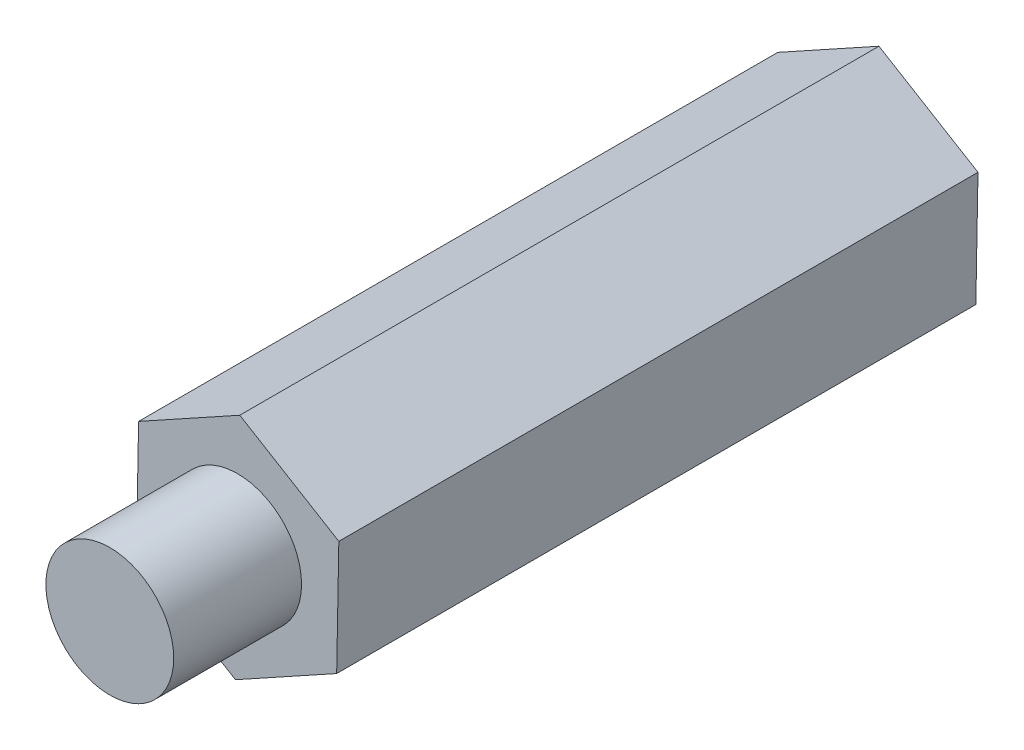
from build123d import *

# Parameters (mm, degrees)
EXTRUDE_1_DEPTH     = 15
SKETCH_2_R          = 1.5
EXTRUDE_2_DEPTH     = 3
SKETCH_3_R          = 1.5
CUT_EXTRUDE_1_DEPTH = 3


with BuildPart() as part:
    # 草图1 → 凸台-拉伸1 (new body)
    with BuildSketch(Plane.XY):
        Polygon((-2.324213399, 1.400487561), (-2.374964505, -1.312584067), (-0.050751106, -2.713071628), (2.324213399, -1.400487561), (2.374964505, 1.312584067), (0.050751106, 2.713071628), align=None)
    extrude(amount=EXTRUDE_1_DEPTH)

    # 草图2 → 凸台-拉伸2 (add)
    with BuildSketch(Plane.XY.offset(15)):
        Circle(SKETCH_2_R)
    extrude(amount=EXTRUDE_2_DEPTH)

    # 草图3 → 切除-拉伸1 (cut)
    with BuildSketch(Plane(origin=(0, 0, 0), x_dir=(-1, 0, 0), z_dir=(0, 0, -1))):
        with Locations(Location((0, 0, 0), (0, 0, 180))):
            Circle(SKETCH_3_R)
    extrude(amount=-CUT_EXTRUDE_1_DEPTH, mode=Mode.SUBTRACT)


solid = part.part
